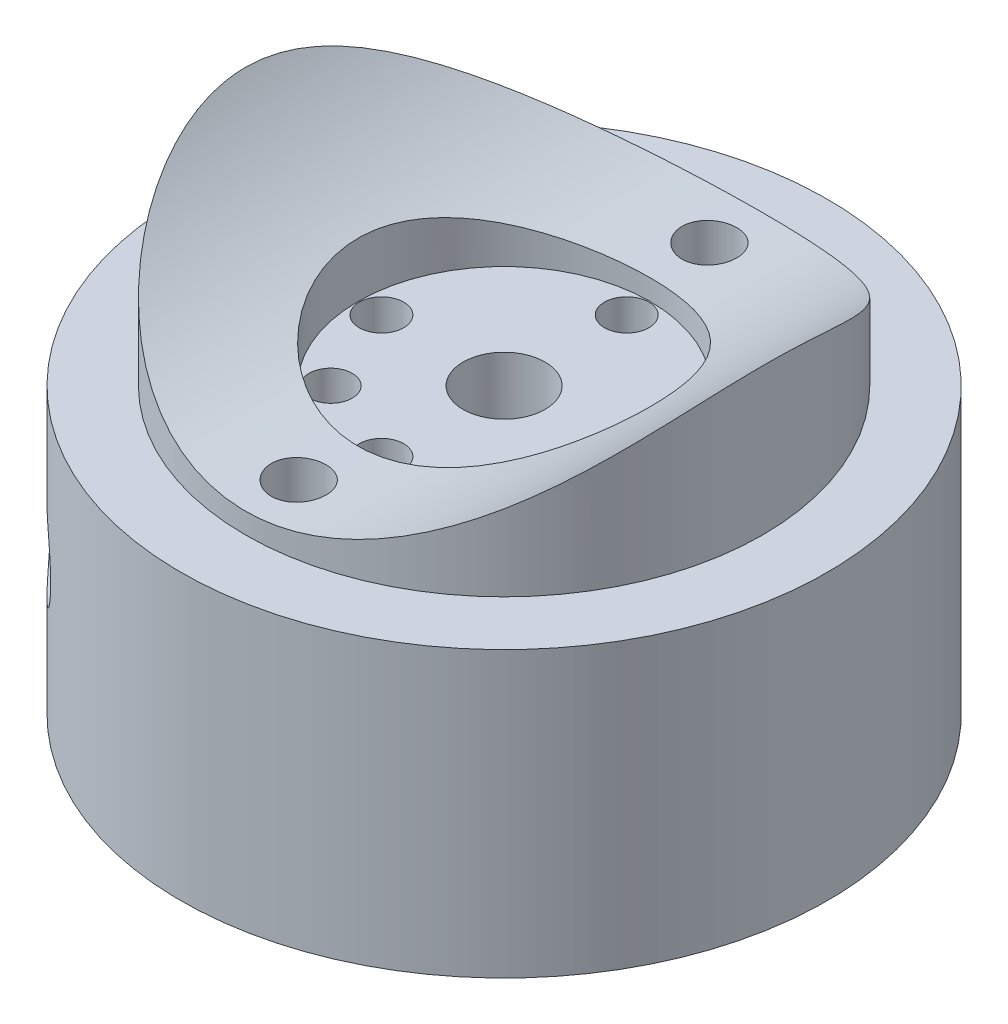
from build123d import *

# Parameters (mm, degrees)
CUT_EXTRUDE1_DEPTH      = 73.886898686
CUT_EXTRUDE1_DEPTH_BACK = 73.886898686
SKETCH2_R               = 38.1
CUT_EXTRUDE2_DEPTH      = 73.886898754
CUT_EXTRUDE2_DEPTH_BACK = 73.886898754
SKETCH3_R               = 4.7625
SKETCH7_R               = 4.7625
CUT_EXTRUDE5_DEPTH      = 22.5
CUT_EXTRUDE3_DEPTH      = 73.886898857
CUT_EXTRUDE3_DEPTH_BACK = 73.886898857
SKETCH4_R               = 3.175
SKETCH4_R_2             = 2.58
SKETCH5_R               = 16.94
CUT_EXTRUDE4_DEPTH      = 63.461988614
SKETCH8_R               = 2.5
CUT_EXTRUDE6_DEPTH      = 20
SKETCH9_R               = 9
CUT_EXTRUDE7_DEPTH      = 18


with BuildPart() as part:
    # Sketch1 → Revolve1 (revolve)
    with BuildSketch(Plane.XY, mode=Mode.PRIVATE) as revolve1_sk:
        Polygon((0, 0), (37.5, 0), (37.5, 33), (30, 33), (30, 50), (0, 50), align=None)
    revolve(revolve1_sk.sketch.rotate(Axis((0, 50, 0), (0, -1, 0)), 180), axis=Axis((0, 50, 0), (0, -1, 0)))

    # Sketch2 → Cut-Extrude1 (cut, two sides: drawn at the far end of the back side and taken through both)
    with BuildSketch(Plane.XY.offset(-CUT_EXTRUDE1_DEPTH_BACK)):
        with Locations((0, 73.486379031)):
            Circle(SKETCH2_R)
    extrude(amount=CUT_EXTRUDE1_DEPTH + CUT_EXTRUDE1_DEPTH_BACK, mode=Mode.SUBTRACT)

    # Sketch3 → Cut-Extrude2 (cut, two sides: drawn at the far end of the back side and taken through both)
    with BuildSketch(Plane.XZ.offset(-CUT_EXTRUDE2_DEPTH_BACK)):
        Circle(SKETCH3_R)
    extrude(amount=CUT_EXTRUDE2_DEPTH + CUT_EXTRUDE2_DEPTH_BACK, mode=Mode.SUBTRACT)

    # Sketch7 → Cut-Extrude5 (cut)
    with BuildSketch(Plane(origin=(-26.516504294, 0, 26.516504294), x_dir=(0, 1, 0), z_dir=(-0.7071067811865464, 0, 0.7071067811865488))):
        with Locations(Location((16.5, 0, 0), (0, 0, 270))):
            Circle(SKETCH7_R)
    extrude(amount=-CUT_EXTRUDE5_DEPTH, mode=Mode.SUBTRACT)

    # Sketch4 → Cut-Extrude3 (cut, two sides: drawn at the far end of the back side and taken through both)
    with BuildSketch(Plane.XZ.offset(-CUT_EXTRUDE3_DEPTH_BACK)):
        with Locations((0, 23.825)):
            Circle(SKETCH4_R)
        with Locations((0, -23.825)):
            Circle(SKETCH4_R)
        with Locations((-14.225, 0)):
            Circle(SKETCH4_R_2)
        with Locations((0, 14.225)):
            Circle(SKETCH4_R_2)
        with Locations((14.225, 0)):
            Circle(SKETCH4_R_2)
        with Locations((0, -14.225)):
            Circle(SKETCH4_R_2)
    extrude(amount=CUT_EXTRUDE3_DEPTH + CUT_EXTRUDE3_DEPTH_BACK, mode=Mode.SUBTRACT)

    # Sketch5 → Cut-Extrude4 (cut, through all)
    with BuildSketch(Plane(origin=(0, 33, 0), x_dir=(1, 0, 0), z_dir=(0, 1, 0))):
        Circle(SKETCH5_R)
    extrude(amount=CUT_EXTRUDE4_DEPTH, mode=Mode.SUBTRACT)

    # Sketch8 → Cut-Extrude6 (cut)
    with BuildSketch(Plane(origin=(0, 33, 0), x_dir=(1, 0, 0), z_dir=(0, 1, 0))):
        with Locations(Location((-10.058593962, -10.058593962, 0), (0, 0, 180))):
            Circle(SKETCH8_R)
    extrude(amount=-CUT_EXTRUDE6_DEPTH, mode=Mode.SUBTRACT)

    # Sketch9 → Cut-Extrude7 (cut)
    with BuildSketch(Plane.XZ):
        Circle(SKETCH9_R)
    extrude(amount=-CUT_EXTRUDE7_DEPTH, mode=Mode.SUBTRACT)


solid = part.part
